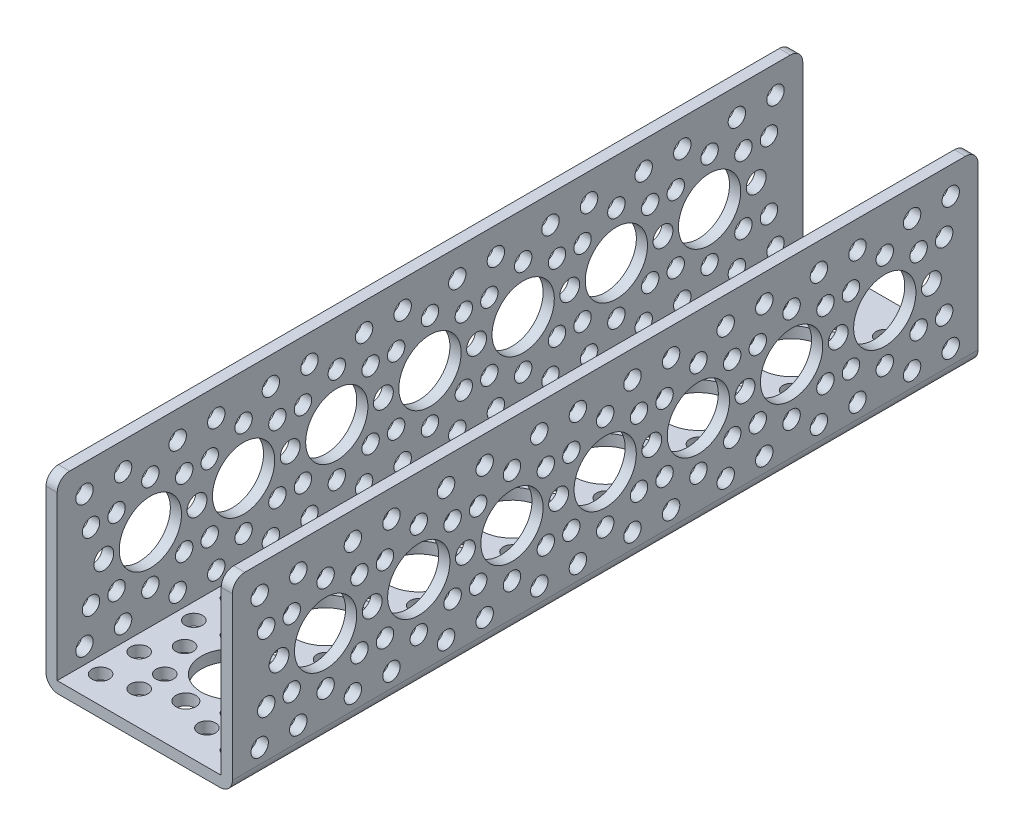
from build123d import *

# Parameters (mm, degrees)
SKETCH1_W                  = 38.1
SKETCH1_H                  = 152.4
BOSS_EXTRUDE1_DEPTH        = 38.1
SKETCH2_W                  = 33.528
SKETCH2_H                  = 35.814
CUT_EXTRUDE1_DEPTH         = 162.644610179
HOLE1_D                    = 12.7254
HOLE1_DEPTH                = 2.286
M3_CLEARANCE_HOLE1_D       = 3.556
M3_CLEARANCE_HOLE1_DEPTH   = 2.286
M3_5_CLEARANCE_HOLE1_D     = 4.064
M3_5_CLEARANCE_HOLE1_DEPTH = 2.286
HOLE2_D                    = 12.7254
HOLE2_DEPTH                = 38.1
M3_5_CLEARANCE_HOLE2_D     = 4.064
M3_5_CLEARANCE_HOLE2_DEPTH = 38.1
M3_CLEARANCE_HOLE2_D       = 3.556
M3_CLEARANCE_HOLE2_DEPTH   = 38.1
HOLE3_D                    = 12.7254
HOLE3_DEPTH                = 38.1
M3_CLEARANCE_HOLE3_D       = 3.556
M3_CLEARANCE_HOLE3_DEPTH   = 38.1
M3_5_CLEARANCE_HOLE3_D     = 4.064
M3_5_CLEARANCE_HOLE3_DEPTH = 38.1
FILLET1_R                  = 2.54


with BuildPart() as part:
    # Sketch1 → Boss-Extrude1 (new body)
    with BuildSketch(Plane.XZ):
        with Locations((19.05, 76.2)):
            Rectangle(SKETCH1_W, SKETCH1_H)
    extrude(amount=-BOSS_EXTRUDE1_DEPTH)

    # Sketch2 → Cut-Extrude1 (cut, through all)
    with BuildSketch(Plane.XY.offset(152.4)):
        with Locations((19.05, 20.193)):
            Rectangle(SKETCH2_W, SKETCH2_H)
    extrude(amount=-CUT_EXTRUDE1_DEPTH, mode=Mode.SUBTRACT)

    # Hole1
    with Locations(Plane(origin=(38.1, 0, 0), x_dir=(0, 0, -1), z_dir=(1, 0, 0))):
        with Locations((-38.1, 19.05), (-19.05, 19.05), (-57.15, 19.05), (-76.2, 19.05), (-95.25, 19.05), (-114.3, 19.05), (-133.35, 19.05)):
            Hole(HOLE1_D / 2, depth=HOLE1_DEPTH)

    # M3 Clearance Hole1
    with Locations(Plane(origin=(38.1, 0, 0), x_dir=(0, 0, -1), z_dir=(1, 0, 0))):
        with Locations((-138.929615818, 5.579615818), (-145.485202787, 12.135202787), (-138.929615818, 32.520384182), (-145.485202787, 25.964797213), (-13.470384182, 5.579615818), (-6.914797213, 12.135202787), (-13.470384182, 32.520384182), (-6.914797213, 25.964797213), (-119.879615818, 5.579615818), (-100.829615818, 5.579615818), (-81.779615818, 5.579615818), (-62.729615818, 5.579615818), (-43.679615818, 5.579615818), (-24.629615818, 5.579615818), (-119.879615818, 32.520384182), (-100.829615818, 32.520384182), (-81.779615818, 32.520384182), (-62.729615818, 32.520384182), (-43.679615818, 32.520384182), (-24.629615818, 32.520384182), (-146.820384182, 5.579615818), (-146.820384182, 32.520384182), (-127.770384182, 5.579615818), (-127.770384182, 32.520384182), (-108.720384182, 5.579615818), (-108.720384182, 32.520384182), (-89.670384182, 5.579615818), (-89.670384182, 32.520384182), (-70.620384182, 5.579615818), (-70.620384182, 32.520384182), (-51.570384182, 5.579615818), (-51.570384182, 32.520384182), (-126.435202787, 12.135202787), (-133.35, 9.271), (-140.264797213, 12.135202787), (-140.264797213, 25.964797213), (-133.35, 28.829), (-107.385202787, 12.135202787), (-114.3, 9.271), (-121.214797213, 12.135202787), (-121.214797213, 25.964797213), (-114.3, 28.829), (-88.335202787, 12.135202787), (-95.25, 9.271), (-102.164797213, 12.135202787), (-102.164797213, 25.964797213), (-95.25, 28.829), (-69.285202787, 12.135202787), (-76.2, 9.271), (-83.114797213, 12.135202787), (-83.114797213, 25.964797213), (-76.2, 28.829), (-50.235202787, 12.135202787), (-57.15, 9.271), (-64.064797213, 12.135202787), (-64.064797213, 25.964797213), (-57.15, 28.829), (-31.185202787, 12.135202787), (-38.1, 9.271), (-45.014797213, 12.135202787), (-45.014797213, 25.964797213), (-38.1, 28.829), (-126.435202787, 25.964797213), (-107.385202787, 25.964797213), (-88.335202787, 25.964797213), (-69.285202787, 25.964797213), (-50.235202787, 25.964797213), (-31.185202787, 25.964797213), (-32.520384182, 5.579615818), (-32.520384182, 32.520384182), (-5.579615818, 5.579615818), (-5.579615818, 32.520384182), (-12.135202787, 12.135202787), (-19.05, 9.271), (-25.964797213, 12.135202787), (-25.964797213, 25.964797213), (-19.05, 28.829), (-12.135202787, 25.964797213)):
            Hole(M3_CLEARANCE_HOLE1_D / 2, depth=M3_CLEARANCE_HOLE1_DEPTH)

    # M3.5 Clearance Hole1
    with Locations(Plane(origin=(38.1, 0, 0), x_dir=(0, 0, -1), z_dir=(1, 0, 0))):
        with Locations((-142.875, 19.05), (-123.825, 19.05), (-104.775, 19.05), (-85.725, 19.05), (-66.675, 19.05), (-47.625, 19.05), (-28.575, 19.05), (-9.525, 19.05)):
            Hole(M3_5_CLEARANCE_HOLE1_D / 2, depth=M3_5_CLEARANCE_HOLE1_DEPTH)

    # Hole2
    with Locations(Plane(origin=(0, 0, 0), x_dir=(-1, 0, 0), z_dir=(0, -1, 0))):
        with Locations((-19.05, -133.35), (-19.05, -114.3), (-19.05, -95.25), (-19.05, -76.2), (-19.05, -57.15), (-19.05, -38.1), (-19.05, -19.05)):
            Hole(HOLE2_D / 2, depth=HOLE2_DEPTH)

    # M3.5 Clearance Hole2
    with Locations(Plane(origin=(0, 0, 0), x_dir=(-1, 0, 0), z_dir=(0, -1, 0))):
        with Locations((-19.05, -142.875), (-19.05, -123.825), (-19.05, -104.775), (-19.05, -85.725), (-19.05, -66.675), (-19.05, -47.625), (-19.05, -28.575), (-19.05, -9.525)):
            Hole(M3_5_CLEARANCE_HOLE2_D / 2, depth=M3_5_CLEARANCE_HOLE2_DEPTH)

    # M3 Clearance Hole2
    with Locations(Plane(origin=(0, 0, 0), x_dir=(-1, 0, 0), z_dir=(0, -1, 0))):
        with Locations((-5.579615818, -146.820384182), (-5.579615818, -138.929615818), (-12.135202787, -145.485202787), (-32.520384182, -146.820384182), (-32.520384182, -138.929615818), (-25.964797213, -145.485202787), (-5.579615818, -127.770384182), (-5.579615818, -119.879615818), (-32.520384182, -127.770384182), (-32.520384182, -119.879615818), (-5.579615818, -108.720384182), (-5.579615818, -100.829615818), (-32.520384182, -108.720384182), (-32.520384182, -100.829615818), (-5.579615818, -89.670384182), (-5.579615818, -81.779615818), (-32.520384182, -89.670384182), (-32.520384182, -81.779615818), (-5.579615818, -70.620384182), (-5.579615818, -62.729615818), (-32.520384182, -70.620384182), (-32.520384182, -62.729615818), (-5.579615818, -51.570384182), (-5.579615818, -43.679615818), (-32.520384182, -51.570384182), (-32.520384182, -43.679615818), (-12.135202787, -126.435202787), (-9.271, -133.35), (-12.135202787, -140.264797213), (-25.964797213, -140.264797213), (-28.829, -133.35), (-25.964797213, -126.435202787), (-12.135202787, -107.385202787), (-9.271, -114.3), (-12.135202787, -121.214797213), (-25.964797213, -121.214797213), (-28.829, -114.3), (-25.964797213, -107.385202787), (-12.135202787, -88.335202787), (-9.271, -95.25), (-12.135202787, -102.164797213), (-25.964797213, -102.164797213), (-28.829, -95.25), (-25.964797213, -88.335202787), (-12.135202787, -69.285202787), (-9.271, -76.2), (-12.135202787, -83.114797213), (-25.964797213, -83.114797213), (-28.829, -76.2), (-25.964797213, -69.285202787), (-12.135202787, -50.235202787), (-9.271, -57.15), (-12.135202787, -64.064797213), (-25.964797213, -64.064797213), (-28.829, -57.15), (-25.964797213, -50.235202787), (-9.271, -38.1), (-12.135202787, -45.014797213), (-25.964797213, -45.014797213), (-28.829, -38.1), (-5.579615818, -32.520384182), (-5.579615818, -24.629615818), (-12.135202787, -31.185202787), (-32.520384182, -32.520384182), (-32.520384182, -24.629615818), (-25.964797213, -31.185202787), (-5.579615818, -5.579615818), (-5.579615818, -13.470384182), (-12.135202787, -6.914797213), (-32.520384182, -5.579615818), (-32.520384182, -13.470384182), (-25.964797213, -6.914797213), (-12.135202787, -12.135202787), (-9.271, -19.05), (-12.135202787, -25.964797213), (-25.964797213, -25.964797213), (-28.829, -19.05), (-25.964797213, -12.135202787)):
            Hole(M3_CLEARANCE_HOLE2_D / 2, depth=M3_CLEARANCE_HOLE2_DEPTH)

    # Hole3
    with Locations(Plane.ZY):
        with Locations((38.1, 19.05), (19.05, 19.05), (57.15, 19.05), (76.2, 19.05), (95.25, 19.05), (114.3, 19.05), (133.35, 19.05)):
            Hole(HOLE3_D / 2, depth=HOLE3_DEPTH)

    # M3 Clearance Hole3
    with Locations(Plane.ZY):
        with Locations((138.929615818, 5.579615818), (145.485202787, 12.135202787), (138.929615818, 32.520384182), (145.485202787, 25.964797213), (13.470384182, 5.579615818), (6.914797213, 12.135202787), (13.470384182, 32.520384182), (6.914797213, 25.964797213), (119.879615818, 5.579615818), (100.829615818, 5.579615818), (81.779615818, 5.579615818), (62.729615818, 5.579615818), (43.679615818, 5.579615818), (24.629615818, 5.579615818), (119.879615818, 32.520384182), (100.829615818, 32.520384182), (81.779615818, 32.520384182), (62.729615818, 32.520384182), (43.679615818, 32.520384182), (24.629615818, 32.520384182), (146.820384182, 5.579615818), (146.820384182, 32.520384182), (127.770384182, 5.579615818), (127.770384182, 32.520384182), (108.720384182, 5.579615818), (108.720384182, 32.520384182), (89.670384182, 5.579615818), (89.670384182, 32.520384182), (70.620384182, 5.579615818), (70.620384182, 32.520384182), (51.570384182, 5.579615818), (51.570384182, 32.520384182), (126.435202787, 12.135202787), (133.35, 9.271), (140.264797213, 12.135202787), (140.264797213, 25.964797213), (133.35, 28.829), (107.385202787, 12.135202787), (114.3, 9.271), (121.214797213, 12.135202787), (121.214797213, 25.964797213), (114.3, 28.829), (88.335202787, 12.135202787), (95.25, 9.271), (102.164797213, 12.135202787), (102.164797213, 25.964797213), (95.25, 28.829), (69.285202787, 12.135202787), (76.2, 9.271), (83.114797213, 12.135202787), (83.114797213, 25.964797213), (76.2, 28.829), (50.235202787, 12.135202787), (57.15, 9.271), (64.064797213, 12.135202787), (64.064797213, 25.964797213), (57.15, 28.829), (31.185202787, 12.135202787), (38.1, 9.271), (45.014797213, 12.135202787), (45.014797213, 25.964797213), (38.1, 28.829), (126.435202787, 25.964797213), (107.385202787, 25.964797213), (88.335202787, 25.964797213), (69.285202787, 25.964797213), (50.235202787, 25.964797213), (31.185202787, 25.964797213), (32.520384182, 5.579615818), (32.520384182, 32.520384182), (5.579615818, 5.579615818), (5.579615818, 32.520384182), (12.135202787, 12.135202787), (19.05, 9.271), (25.964797213, 12.135202787), (25.964797213, 25.964797213), (19.05, 28.829), (12.135202787, 25.964797213)):
            Hole(M3_CLEARANCE_HOLE3_D / 2, depth=M3_CLEARANCE_HOLE3_DEPTH)

    # M3.5 Clearance Hole3
    with Locations(Plane.ZY):
        with Locations((142.875, 19.05), (123.825, 19.05), (104.775, 19.05), (85.725, 19.05), (66.675, 19.05), (47.625, 19.05), (28.575, 19.05), (9.525, 19.05)):
            Hole(M3_5_CLEARANCE_HOLE3_D / 2, depth=M3_5_CLEARANCE_HOLE3_DEPTH)

    # Fillet1
    fillet1_edges = [part.edges().sort_by_distance(p)[0] for p in [
        (1.143, 38.1, 0),
        (36.957, 38.1, 0),
        (1.143, 38.1, 152.4),
        (0, 0, 76.2),
        (38.1, 0, 76.2),
        (36.957, 38.1, 152.4),
    ]]
    fillet(fillet1_edges, radius=FILLET1_R)


solid = part.part
